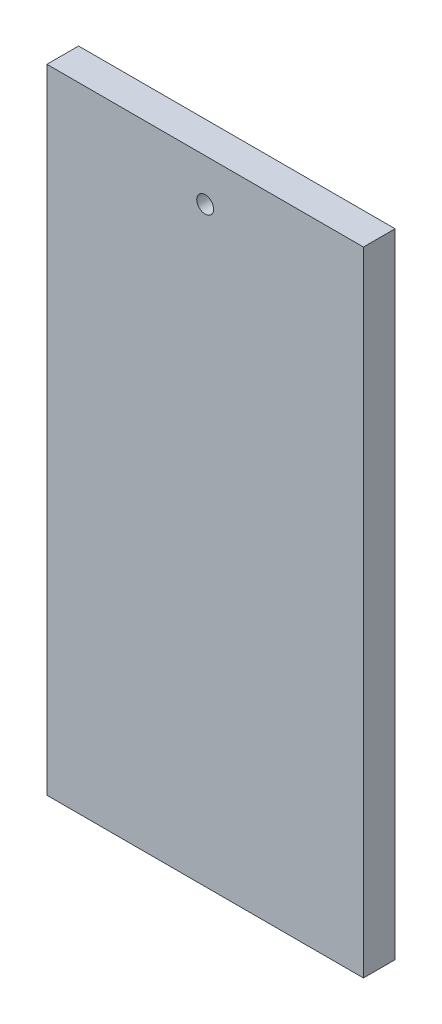
from build123d import *

# Parameters (mm, degrees)
SKETCH1_W           = 150
SKETCH1_H           = 300
SKETCH1_R           = 4
BOSS_EXTRUDE1_DEPTH = 15


with BuildPart() as part:
    # Sketch1 → Boss-Extrude1 (new body)
    with BuildSketch(Plane.XY):
        Rectangle(SKETCH1_W, SKETCH1_H)
        with Locations((0, 130)):
            Circle(SKETCH1_R, mode=Mode.SUBTRACT)
    extrude(amount=BOSS_EXTRUDE1_DEPTH)


solid = part.part
